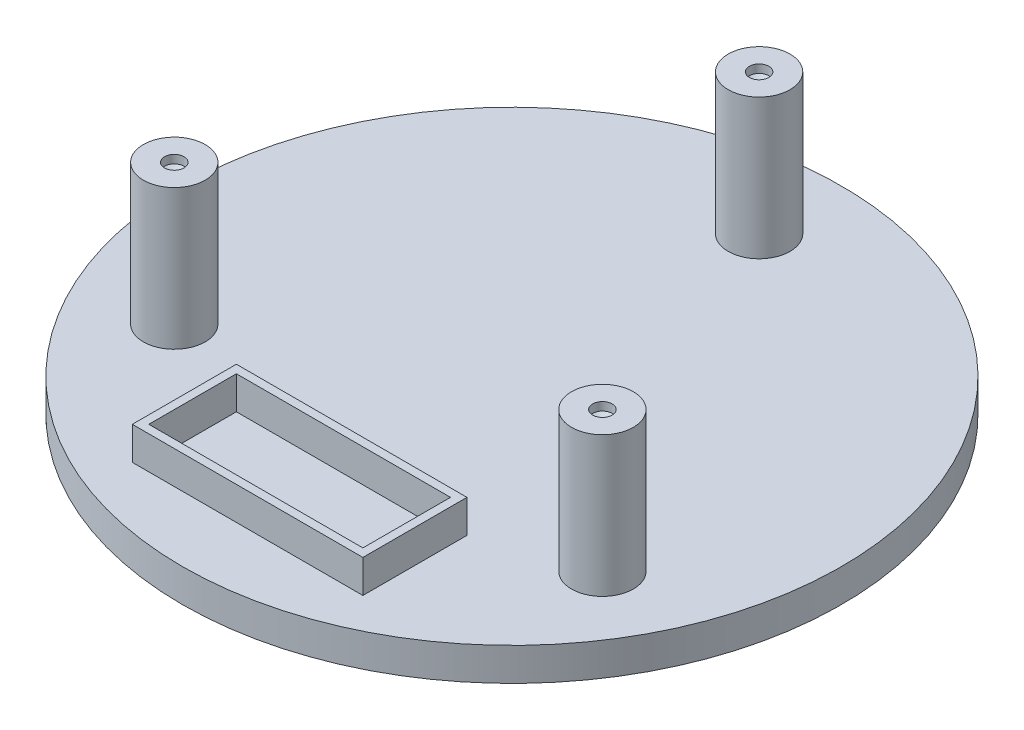
from build123d import *

# Parameters (mm, degrees)
SKETCH3_R                 = 4.7625
BOSS_EXTRUDE1_DEPTH       = 21.59
M4X0_7_TAPPED_HOLE1_D     = 3
M4X0_7_TAPPED_HOLE1_DEPTH = 1.27
M4X0_7_TAPPED_HOLE1_TIP   = 0.901290929
SKETCH12_W                = 35.54
SKETCH12_H                = 16.04
SKETCH12_W_2              = 33
SKETCH12_H_2              = 13.5
BOSS_EXTRUDE2_DEPTH       = 5.08


with BuildPart() as part:
    # Sketch1 → Revolve1 (revolve)
    with BuildSketch(Plane.XY, mode=Mode.PRIVATE) as revolve1_sk:
        Polygon((-38.1, -2.54), (0, -2.54), (0, 0), (-50.8, 0), (-50.8, -5.08), (-38.1, -5.08), align=None)
    revolve(revolve1_sk.sketch.rotate(Axis((0, 4.567685351, 0), (0, -1, 0)), 270), axis=Axis((0, 4.567685351, 0), (0, -1, 0)))

    # Sketch3 → Boss-Extrude1 (add)
    with BuildSketch(Plane(origin=(0, 0, 0), x_dir=(1, 0, 0), z_dir=(0, 1, 0))):
        with Locations(Location((0, 38.1, 0), (0, 0, 270))):
            Circle(SKETCH3_R)
        with Locations(Location((-32.995567884, -19.05, 0), (0, 0, 270))):
            Circle(SKETCH3_R)
        with Locations(Location((32.995567884, -19.05, 0), (0, 0, 270))):
            Circle(SKETCH3_R)
    extrude(amount=BOSS_EXTRUDE1_DEPTH)

    # M4x0.7 Tapped Hole1
    with Locations(Plane(origin=(0, 21.59, 0), x_dir=(1, 0, 0), z_dir=(0, 1, 0))):
        with Locations((-32.995567884, -19.05), (0, 38.1), (32.995567884, -19.05)):
            Hole(M4X0_7_TAPPED_HOLE1_D / 2, depth=M4X0_7_TAPPED_HOLE1_DEPTH)
            with Locations((0, 0, -(M4X0_7_TAPPED_HOLE1_DEPTH + M4X0_7_TAPPED_HOLE1_TIP / 2))):  # 118° drill point
                Cone(0, M4X0_7_TAPPED_HOLE1_D / 2, M4X0_7_TAPPED_HOLE1_TIP, mode=Mode.SUBTRACT)

    # Sketch12 → Boss-Extrude2 (add)
    with BuildSketch(Plane(origin=(0, 0, 0), x_dir=(1, 0, 0), z_dir=(0, 1, 0))):
        with Locations((0, -32.723460825)):
            Rectangle(SKETCH12_W, SKETCH12_H)
        with Locations((0, -32.723460825)):
            Rectangle(SKETCH12_W_2, SKETCH12_H_2, mode=Mode.SUBTRACT)
    extrude(amount=BOSS_EXTRUDE2_DEPTH)


solid = part.part
